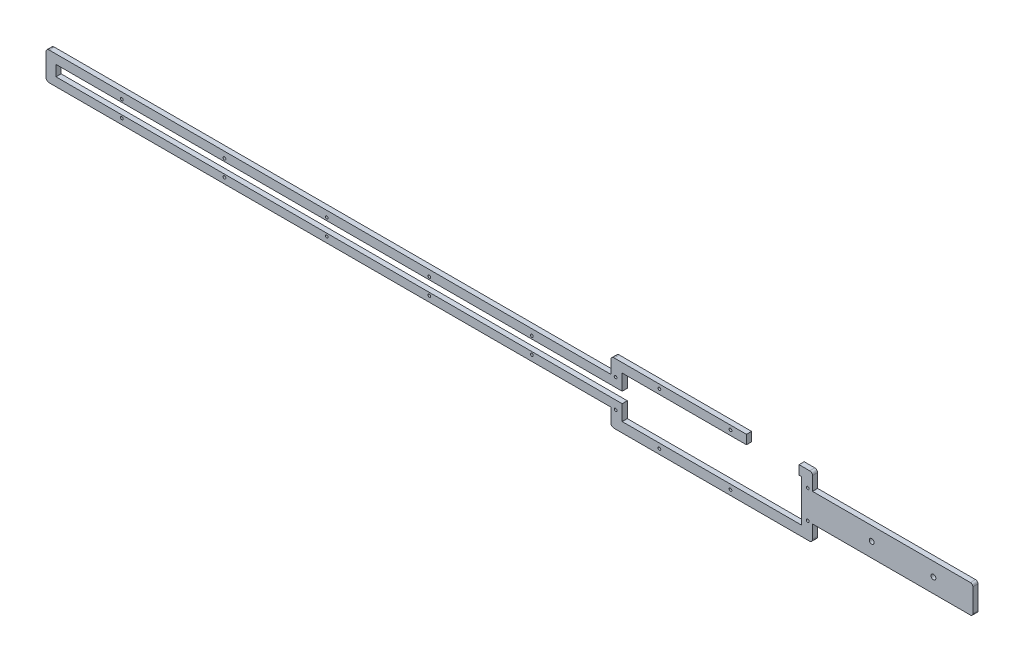
from build123d import *

# Parameters (mm, degrees)
SKETCH1_R           = 1.720095417
SKETCH1_R_2         = 1.632335783
SKETCH1_R_3         = 3.048
BOSS_EXTRUDE1_DEPTH = 6.35


with BuildPart() as part:
    # Sketch1 → Boss-Extrude1 (new body)
    with BuildSketch(Plane.XY):
        with BuildLine():
            Line((0.359622665, 112.547896558), (0.359622665, 84.647626996))
            ThreePointArc((0.359622665, 84.647626996), (1.569547298, 82.016705042), (4.285435965, 81.011908201))
            Line((4.285435965, 81.011908201), (699.960441306, 81.011908201))
            Line((699.960441306, 81.011908201), (699.960441306, 64.012598058))
            ThreePointArc((699.960441306, 64.012598058), (701.213068629, 61.288906282), (704.024750828, 60.24870663))
            Line((704.024750828, 60.24870663), (943.890172073, 60.24870663))
            Line((943.890172073, 60.24870663), (946.192785632, 60.24870663))
            ThreePointArc((946.192785632, 60.24870663), (948.74540471, 61.39621374), (949.738968911, 64.012598058))
            Line((949.738968911, 64.012598058), (949.738968911, 80.56870663))
            Line((949.738968911, 80.56870663), (1145.318968911, 80.56870663))
            ThreePointArc((1145.318968911, 80.56870663), (1147.47423038, 81.461445161), (1148.366968911, 83.61670663))
            Line((1148.366968911, 83.61670663), (1148.366968911, 112.444795653))
            ThreePointArc((1148.366968911, 112.444795653), (1147.47423038, 114.600057122), (1145.318968911, 115.492795653))
            Line((1145.318968911, 115.492795653), (949.738968911, 115.492795653))
            Line((949.738968911, 115.492795653), (949.738968911, 132.475411377))
            ThreePointArc((949.738968911, 132.475411377), (948.657072186, 134.878542119), (946.192785632, 135.812795653))
            Line((946.192785632, 135.812795653), (943.890172073, 135.812795653))
            Line((943.890172073, 135.812795653), (933.071984653, 135.812795653))
            Line((933.071984653, 135.812795653), (933.071984653, 124.543323228))
            Line((933.071984653, 124.543323228), (935.984655082, 124.543323228))
            Line((935.984655082, 124.543323228), (935.984655082, 72.51225313))
            Line((935.984655082, 72.51225313), (714.00720644, 72.51225313))
            Line((714.00720644, 72.51225313), (714.00720644, 91.663924817))
            Line((714.00720644, 91.663924817), (12.71320644, 91.663924817))
            Line((12.71320644, 91.663924817), (12.71320644, 104.995667719))
            Line((12.71320644, 104.995667719), (714.00720644, 104.995667719))
            Line((714.00720644, 104.995667719), (714.00720644, 124.543323228))
            Line((714.00720644, 124.543323228), (867.944172073, 124.543323228))
            Line((867.944172073, 124.543323228), (867.944172073, 130.611938178))
            Line((867.944172073, 130.611938178), (867.944172073, 135.812795653))
            Line((867.944172073, 135.812795653), (704.024750828, 135.812795653))
            ThreePointArc((704.024750828, 135.812795653), (701.183091811, 134.700225562), (699.960441306, 131.904163347))
            Line((699.960441306, 131.904163347), (699.960441306, 116.18243367))
            Line((699.960441306, 116.18243367), (4.285435965, 116.18243367))
            ThreePointArc((4.285435965, 116.18243367), (1.569792033, 115.17822767), (0.359622665, 112.547896558))
        make_face()
        with Locations((94.1622142, 88.091107164)):
            Circle(SKETCH1_R, mode=Mode.SUBTRACT)
        with Locations((221.392126764, 88.091107164)):
            Circle(SKETCH1_R, mode=Mode.SUBTRACT)
        with Locations((348.078760153, 88.091107164)):
            Circle(SKETCH1_R_2, mode=Mode.SUBTRACT)
        with Locations((475.146430575, 88.091107164)):
            Circle(SKETCH1_R, mode=Mode.SUBTRACT)
        with Locations((760.070975046, 66.505299661)):
            Circle(SKETCH1_R, mode=Mode.SUBTRACT)
        with Locations((848.138968911, 66.505299661)):
            Circle(SKETCH1_R, mode=Mode.SUBTRACT)
        with Locations((705.892847696, 81.011908201)):
            Circle(SKETCH1_R, mode=Mode.SUBTRACT)
        with Locations((602.130384222, 88.091107164)):
            Circle(SKETCH1_R, mode=Mode.SUBTRACT)
        with BuildLine():
            ThreePointArc((945.610267489, 81.011908201), (945.106463206, 79.795617068), (943.890172073, 79.291812784))
            ThreePointArc((943.890172073, 79.291812784), (942.673880939, 82.228199334), (945.610267489, 81.011908201))
        make_face(mode=Mode.SUBTRACT)
        with Locations((94.1622142, 108.484732819)):
            Circle(SKETCH1_R, mode=Mode.SUBTRACT)
        with Locations((221.392126764, 108.484732819)):
            Circle(SKETCH1_R, mode=Mode.SUBTRACT)
        with Locations((348.078760153, 108.484732819)):
            Circle(SKETCH1_R, mode=Mode.SUBTRACT)
        with Locations((475.146430575, 108.484732819)):
            Circle(SKETCH1_R, mode=Mode.SUBTRACT)
        with Locations((602.130384222, 108.484732819)):
            Circle(SKETCH1_R, mode=Mode.SUBTRACT)
        with Locations((705.892847696, 116.18243367)):
            Circle(SKETCH1_R, mode=Mode.SUBTRACT)
        with Locations((1023.106655082, 98.527788179)):
            Circle(SKETCH1_R_3, mode=Mode.SUBTRACT)
        with Locations((1099.420523291, 98.527788179)):
            Circle(SKETCH1_R_3, mode=Mode.SUBTRACT)
        with BuildLine():
            ThreePointArc((945.610267489, 116.18243367), (942.673880939, 114.966142537), (943.890172073, 117.902529086))
            ThreePointArc((943.890172073, 117.902529086), (945.106463206, 117.398724803), (945.610267489, 116.18243367))
        make_face(mode=Mode.SUBTRACT)
        with Locations((760.070975046, 130.611938178)):
            Circle(SKETCH1_R, mode=Mode.SUBTRACT)
        with Locations((848.138968911, 130.611938178)):
            Circle(SKETCH1_R, mode=Mode.SUBTRACT)
    extrude(amount=BOSS_EXTRUDE1_DEPTH)


solid = part.part
